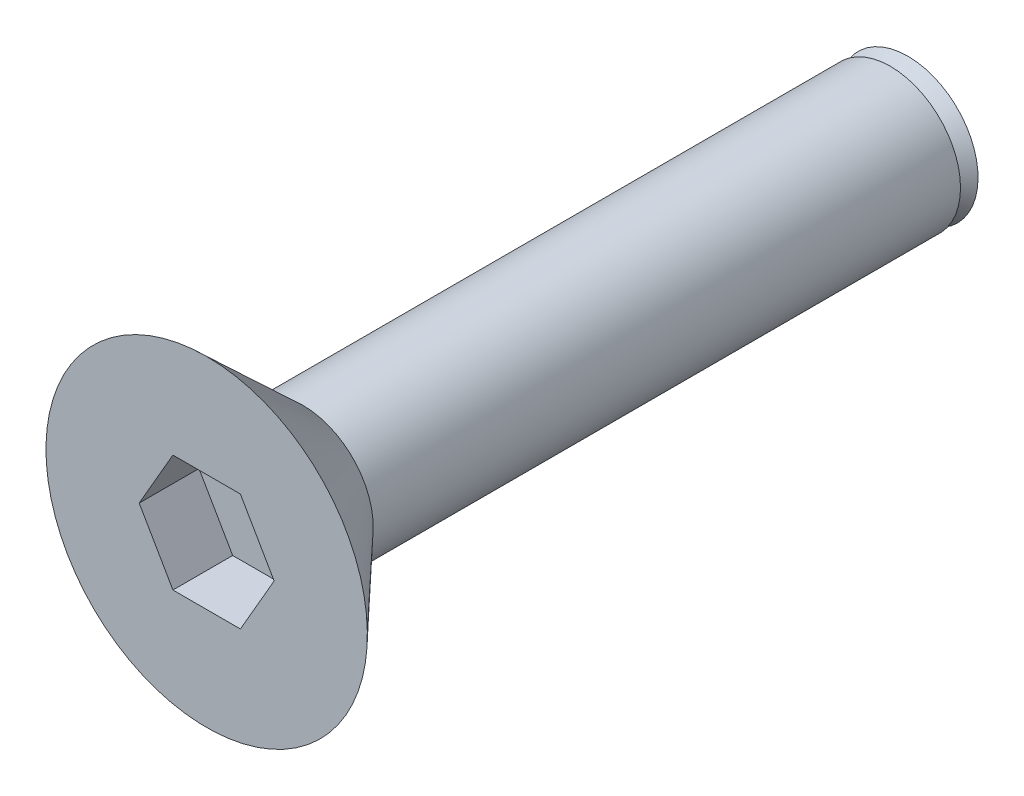
from build123d import *

# Parameters (mm, degrees)
F_0165_CONE_ROTATE_ANGLE    = 90
F_0166_CYLINDER_SKETCH_R    = 1.2
F_0166_CYLINDER_DEPTH       = 10.05
F_0167_CONE_ROTATE_ANGLE    = 90
F_0172_EXTRUDE_DEPTH        = 1.033
F_0172_EXTRUDE_ROTATE_ANGLE = 120


with BuildPart() as part:
    # 0165_cone_Sketch → 0165_cone (revolve)
    with BuildSketch(Plane.XY, mode=Mode.PRIVATE) as f_0165_cone_sk:
        Polygon((0, 0), (1.2, 0), (2.75, 1.65), (0, 1.65), align=None)
    revolve(f_0165_cone_sk.sketch.rotate(Axis((0, -100, 0), (0, 1, 0)), 90), axis=Axis((0, -100, 0), (0, 1, 0)))


with BuildPart() as part_1:
    # 0165_cone_Rotate: moved
    add(part.part.rotate(Axis((0, 0, 0), (1, 0, 0)), F_0165_CONE_ROTATE_ANGLE))


with BuildPart() as part_2:
    # 0165_cone_Translate: moved
    add(part_1.part.moved(Location((0, 0, -1.65))))


with BuildPart() as body_2:
    # 0166_cylinder_Sketch → 0166_cylinder (new body)
    with BuildSketch(Plane.XY):
        Circle(F_0166_CYLINDER_SKETCH_R)
    extrude(amount=F_0166_CYLINDER_DEPTH)


with BuildPart() as body_2_1:
    # 0166_cylinder_Translate: moved
    add(body_2.part.moved(Location((0, 0, -11.7))))


with BuildPart() as body_3:
    # 0167_cone_Sketch → 0167_cone (revolve)
    with BuildSketch(Plane.XY, mode=Mode.PRIVATE) as f_0167_cone_sk:
        Polygon((0, 0), (1.2, 0), (0.9, 0.3), (0, 0.3), align=None)
    revolve(f_0167_cone_sk.sketch.rotate(Axis((0, -100, 0), (0, 1, 0)), 90), axis=Axis((0, -100, 0), (0, 1, 0)))


with BuildPart() as body_3_1:
    # 0167_cone_Rotate: moved
    add(body_3.part.rotate(Axis((0, 0, 0), (1, 0, 0)), F_0167_CONE_ROTATE_ANGLE))


with BuildPart() as body_3_2:
    # 0167_cone_Translate: moved
    add(body_3_1.part.moved(Location((0, 0, -12))))


with BuildPart() as body_2_2:
    add(body_2_1.part)

    # 0169_add: union body 3
    add(body_3_2.part)


with BuildPart() as part_3:
    add(part_2.part)

    # 0171_add: union body 2
    add(body_2_2.part)


with BuildPart() as body_2_2_1:
    # 0172_extrude_Sketch → 0172_extrude (new body)
    with BuildSketch(Plane.XY):
        Polygon((0, 0), (1.154700538, 0), (1.732050808, 1), (1.154700538, 2), (0, 2), (-0.577350269, 1), align=None)
    extrude(amount=F_0172_EXTRUDE_DEPTH)


with BuildPart() as body_2_2_2:
    # 0172_extrude_Rotate: moved
    add(body_2_2_1.part.rotate(Axis((0, 0, 0), (0, 0, 1)), F_0172_EXTRUDE_ROTATE_ANGLE))


with BuildPart() as body_2_2_3:
    # 0172_extrude_Translate: moved
    add(body_2_2_2.part.moved(Location((1.154700538, 0, -1.023))))


with BuildPart() as part_4:
    add(part_3.part)

    # 0174_sub: cut body 2 2
    add(body_2_2_3.part, mode=Mode.SUBTRACT)


solid = part_4.part
